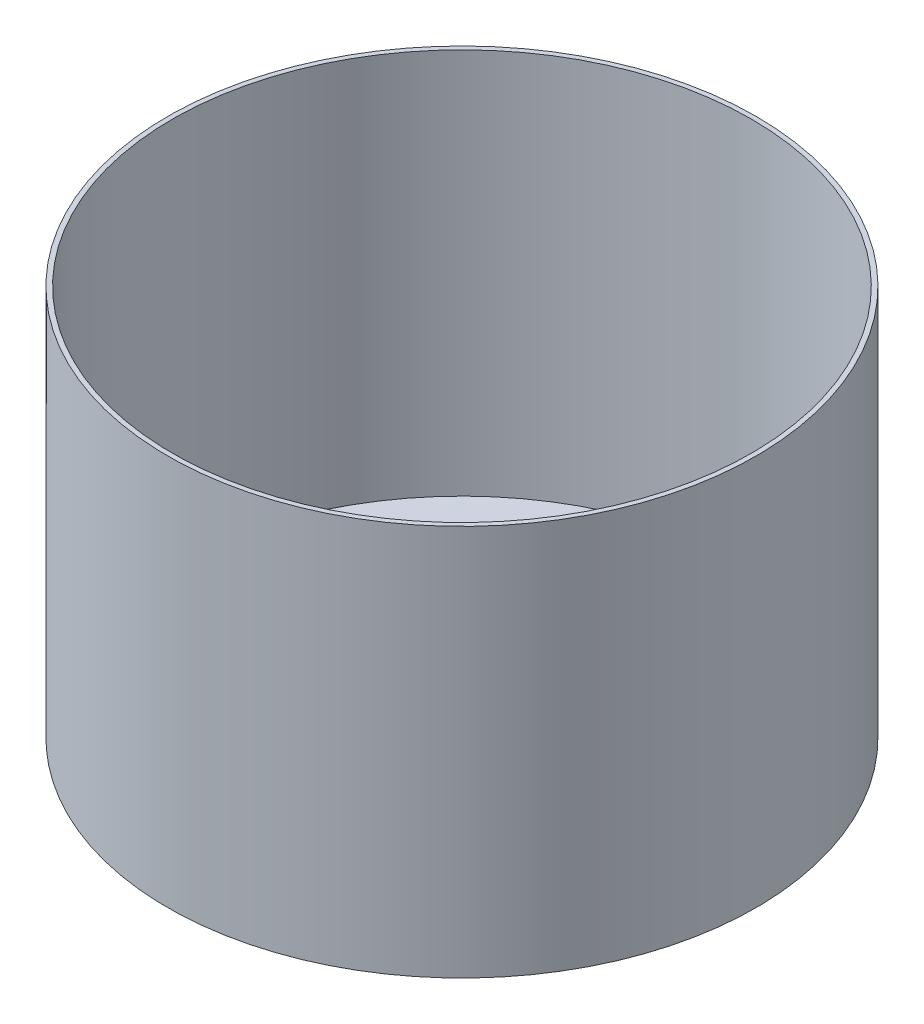
from build123d import *

# Parameters (mm, degrees)
CUT_EXTRUDE2_REACH = 187.394
MOTOR_HOLE_R       = 25.4
MOTOR_HOLE_R_2     = 3.048


with BuildPart() as part:
    # Compartment → Revolve1 (revolve)
    with BuildSketch(Plane.XY, mode=Mode.PRIVATE) as revolve1_sk:
        Polygon((95.504, -80), (0, -80), (0, -78.476), (93.98, -78.476), (93.98, 47), (95.504, 47), align=None)
    revolve(revolve1_sk.sketch.rotate(Axis((0, 0, 0), (0, 1, 0)), 90), axis=Axis((0, 0, 0), (0, 1, 0)))

    # Motor Hole → Cut-Extrude2 (cut, up to next)
    with BuildSketch(Plane.XZ.offset(80), mode=Mode.PRIVATE) as cut_extrude2_sk1:
        with Locations(Location((0, 0, 0), (0, 0, 270))):
            Circle(MOTOR_HOLE_R)
    cut_extrude2_tool1 = extrude(cut_extrude2_sk1.sketch, amount=-CUT_EXTRUDE2_REACH, mode=Mode.PRIVATE) & part.part
    # Motor Hole → Cut-Extrude2 (cut, up to next)
    with BuildSketch(Plane.XZ.offset(80), mode=Mode.PRIVATE) as cut_extrude2_sk2:
        with Locations(Location((0, 80.01, 0), (0, 0, 270))):
            Circle(MOTOR_HOLE_R_2)
    cut_extrude2_tool2 = extrude(cut_extrude2_sk2.sketch, amount=-CUT_EXTRUDE2_REACH, mode=Mode.PRIVATE) & part.part
    # Motor Hole → Cut-Extrude2 (cut, up to next)
    with BuildSketch(Plane.XZ.offset(80), mode=Mode.PRIVATE) as cut_extrude2_sk3:
        with Locations(Location((80.01, 0, 0), (0, 0, 270))):
            Circle(MOTOR_HOLE_R_2)
    cut_extrude2_tool3 = extrude(cut_extrude2_sk3.sketch, amount=-CUT_EXTRUDE2_REACH, mode=Mode.PRIVATE) & part.part
    # Motor Hole → Cut-Extrude2 (cut, up to next)
    with BuildSketch(Plane.XZ.offset(80), mode=Mode.PRIVATE) as cut_extrude2_sk4:
        with Locations(Location((0, -80.01, 0), (0, 0, 270))):
            Circle(MOTOR_HOLE_R_2)
    cut_extrude2_tool4 = extrude(cut_extrude2_sk4.sketch, amount=-CUT_EXTRUDE2_REACH, mode=Mode.PRIVATE) & part.part
    # Motor Hole → Cut-Extrude2 (cut, up to next)
    with BuildSketch(Plane.XZ.offset(80), mode=Mode.PRIVATE) as cut_extrude2_sk5:
        with Locations(Location((-80.01, 0, 0), (0, 0, 270))):
            Circle(MOTOR_HOLE_R_2)
    cut_extrude2_tool5 = extrude(cut_extrude2_sk5.sketch, amount=-CUT_EXTRUDE2_REACH, mode=Mode.PRIVATE) & part.part
    add(cut_extrude2_tool1.solids().sort_by_distance((0, -80, 0))[0], mode=Mode.SUBTRACT)
    add(cut_extrude2_tool2.solids().sort_by_distance((0, -80, 80.01))[0], mode=Mode.SUBTRACT)
    add(cut_extrude2_tool3.solids().sort_by_distance((80.01, -80, 0))[0], mode=Mode.SUBTRACT)
    add(cut_extrude2_tool4.solids().sort_by_distance((0, -80, -80.01))[0], mode=Mode.SUBTRACT)
    add(cut_extrude2_tool5.solids().sort_by_distance((-80.01, -80, 0))[0], mode=Mode.SUBTRACT)


solid = part.part
